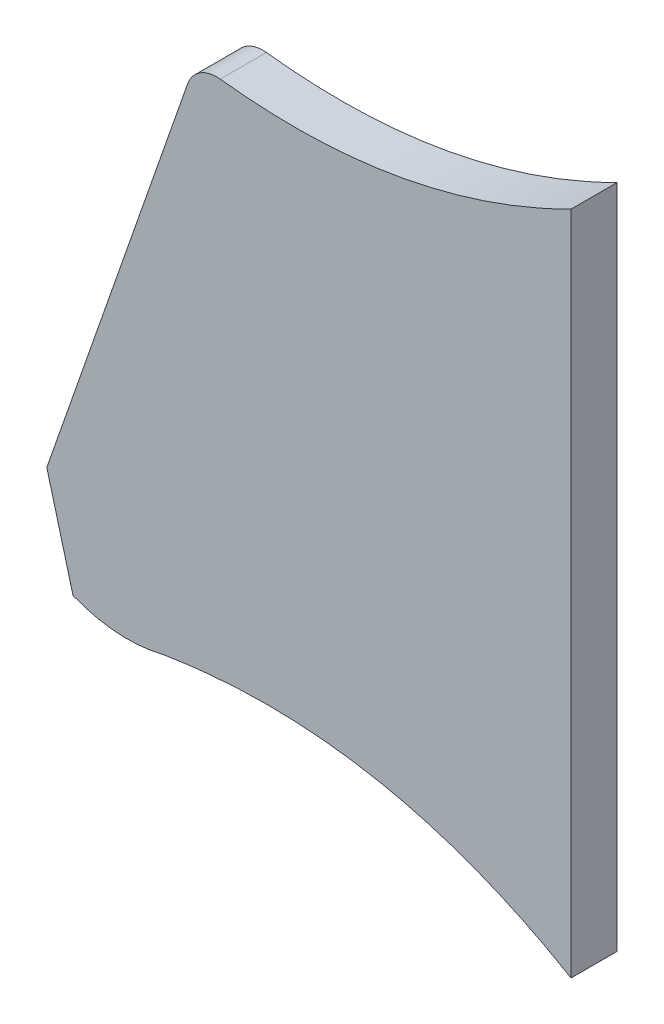
from build123d import *

# Parameters (mm, degrees)
EXTRUDE_1_DEPTH      = 3
EXTRUDE_2_DEPTH      = 3
CUT_EXTRUDE_1_DEPTH  = 10
CUT_EXTRUDE_2_DEPTH  = 10
FILLET_1_R           = 2
CUT_EXTRUDE_3_DEPTH  = 10
CUT_EXTRUDE_4_DEPTH  = 10
CUT_EXTRUDE_5_DEPTH  = 10
CUT_EXTRUDE_6_DEPTH  = 10
CUT_EXTRUDE_7_DEPTH  = 10
EXTRUDE_3_DEPTH      = 3
EXTRUDE_4_DEPTH      = 3
EXTRUDE_5_DEPTH      = 3
CUT_EXTRUDE_8_DEPTH  = 10
CUT_EXTRUDE_9_DEPTH  = 10
CUT_EXTRUDE_10_DEPTH = 10
EXTRUDE_7_DEPTH      = 3
CUT_EXTRUDE_11_DEPTH = 10
CUT_EXTRUDE_12_DEPTH = 10
CUT_EXTRUDE_13_DEPTH = 10
FILLET_2_R           = 2


with BuildPart() as part:
    # 草图1 → 凸台-拉伸1 (new body)
    with BuildSketch(Plane.XY):
        Polygon((18.419709666, -31.180034248), (-18.99770992, -2.648675004), (-11.516544217, 31.616418832), (-4.12729008, 31.616418832), (18.99770992, 31.616418832), (18.99770992, -31.616418832), align=None)
    extrude(amount=EXTRUDE_1_DEPTH)

    # 草图2 → 凸台-拉伸2 (add)
    with BuildSketch(Plane.XY.offset(3)):
        Polygon((18.99770992, 31.616418832), (18.99770992, 39.616418832), (-11.516544217, 31.616418832), align=None)
    extrude(amount=-EXTRUDE_2_DEPTH)

    # 草图3 → 切除-拉伸1 (cut)
    with BuildSketch(Plane.XY.offset(3)):
        with BuildLine():
            Line((-18.99770992, -2.648675004), (18.419709666, -31.180034248))
            Line((18.419709666, -31.180034248), (18.99770992, -31.616418832))
            add(Edge.make_bspline(
                [(-18.99770992, -2.648675004), (-4.909401081, -6.664762391), (12.96021978, -16.653979791), (18.99770992, -31.616418832)],
                knots=[0, 0, 0, 0, 0.839418351, 0.839418351, 0.839418351, 0.839418351], degree=3))
        make_face()
    extrude(amount=-CUT_EXTRUDE_1_DEPTH, mode=Mode.SUBTRACT)

    # 草图4 → 切除-拉伸2 (cut)
    with BuildSketch(Plane.XY.offset(3)):
        with BuildLine():
            Line((18.99770992, 39.616418832), (-11.516544217, 31.616418832))
            add(Edge.make_bspline(
                [(-11.516544217, 31.616418832), (5.451208804, 29.787696143), (18.99770992, 39.616418832)],
                knots=[0, 0, 0, 1, 1, 1], degree=2))
        make_face()
    extrude(amount=-CUT_EXTRUDE_2_DEPTH, mode=Mode.SUBTRACT)

    # 圆角1
    fillet_1_edges = [part.edges().sort_by_distance(p)[0] for p in [
        (-11.516544217, 31.616418832, 1.5),
        (-18.99770992, -2.648675004, 1.5),
    ]]
    fillet(fillet_1_edges, radius=FILLET_1_R)

    # 草图5 → 切除-拉伸3 (cut)
    with BuildSketch(Plane.XY.offset(3)):
        with BuildLine():
            Line((-15.247678714, 14.527147092), (-18.602325656, -0.837743464))
            ThreePointArc((-18.602325656, -0.837743464), (-18.37793511, -2.26862535), (-17.246477615, -3.172825565))
            add(Edge.make_bspline(
                [(-5.349580984, -8.035622202), (-9.34088255, -6.003793842), (-13.405831379, -4.376501244), (-17.246477615, -3.172825565)],
                knots=[0.580679004, 0.580679004, 0.580679004, 0.580679004, 0.804994854, 0.804994854, 0.804994854, 0.804994854], degree=3))
            Line((-5.349580984, -8.035622202), (-15.247678714, 14.527147092))
        make_face()
    extrude(amount=-CUT_EXTRUDE_3_DEPTH, mode=Mode.SUBTRACT)

    # 草图6 → 切除-拉伸4 (cut)
    with BuildSketch(Plane.XY.offset(3)):
        with BuildLine():
            Line((18.99770992, -31.616418832), (18.99770992, -24.041974817))
            add(Edge.make_bspline(
                [(-5.349580984, -8.035622202), (10.712822768, -10.603879461), (18.99770992, -24.041974817)],
                knots=[0, 0, 0, 1, 1, 1], degree=2))
            add(Edge.make_bspline(
                [(18.99770992, -31.616418832), (14.821194408, -21.265949132), (4.982569087, -13.295348934), (-5.349580984, -8.035622202)],
                knots=[0, 0, 0, 0, 0.580679004, 0.580679004, 0.580679004, 0.580679004], degree=3))
        make_face()
    extrude(amount=-CUT_EXTRUDE_4_DEPTH, mode=Mode.SUBTRACT)

    # 草图7 → 切除-拉伸5 (cut)
    with BuildSketch(Plane.XY.offset(3)):
        with BuildLine():
            Line((-7.501131826, -3.13114999), (-5.349580984, -8.035622202))
            add(Edge.make_bspline(
                [(18.99770992, -24.041974817), (10.712822768, -10.603879461), (-5.349580984, -8.035622202)],
                knots=[0, 0, 0, 1, 1, 1], degree=2))
            Line((18.99770992, -24.041974817), (18.99770992, -15.72868914))
            add(Edge.make_bspline(
                [(-7.501131826, -3.13114999), (8.534248318, -3.706395951), (18.99770992, -15.72868914)],
                knots=[0, 0, 0, 1, 1, 1], degree=2))
        make_face()
    extrude(amount=-CUT_EXTRUDE_5_DEPTH, mode=Mode.SUBTRACT)

    # 草图9 → 切除-拉伸6 (cut)
    with BuildSketch(Plane.XY.offset(3)):
        with BuildLine():
            Line((-15.247678714, 14.527147092), (-5.393109321, 31.338029381))
            add(Edge.make_bspline(
                [(-9.792557358, 31.460050353), (-7.562671253, 31.296266706), (-5.393109321, 31.338029381)],
                knots=[0, 0, 0, 1, 1, 1], degree=2))
            ThreePointArc((-9.792557358, 31.460050353), (-11.135472525, 31.068108787), (-11.893031771, 29.892037648))
            Line((-11.893031771, 29.892037648), (-15.247678714, 14.527147092))
        make_face()
    extrude(amount=-CUT_EXTRUDE_6_DEPTH, mode=Mode.SUBTRACT)

    # 草图10 → 切除-拉伸7 (cut)
    with BuildSketch(Plane.XY.offset(3)):
        Polygon((-15.247678714, 14.527147092), (-5.393109321, 31.338029381), (-13.423981873, 10.370019914), align=None)
    extrude(amount=-CUT_EXTRUDE_7_DEPTH, mode=Mode.SUBTRACT)

    # 草图11 → 凸台-拉伸3 (add)
    with BuildSketch(Plane.XY.offset(3)):
        Polygon((-13.423981873, 3.619434962), (-7.501131826, -3.13114999), (-13.423981873, 10.370019914), align=None)
        Polygon((-13.423981873, 16.619434962), (-13.423981873, 10.370019914), (-5.393109321, 31.338029381), align=None)
    extrude(amount=-EXTRUDE_3_DEPTH)

    # 草图12 → 凸台-拉伸4 (add)
    with BuildSketch(Plane.XY.offset(3)):
        with BuildLine():
            Line((18.99770992, -15.72868914), (18.99770992, -16.37868914))
            add(Edge.make_bspline(
                [(-7.501131826, -3.13114999), (8.231572952, -4.86202672), (18.99770992, -16.37868914)],
                knots=[0, 0, 0, 1, 1, 1], degree=2))
            add(Edge.make_bspline(
                [(-7.501131826, -3.13114999), (8.534248318, -3.706395951), (18.99770992, -15.72868914)],
                knots=[0, 0, 0, 1, 1, 1], degree=2))
        make_face()
    extrude(amount=-EXTRUDE_4_DEPTH)

    # 草图14 → 凸台-拉伸5 (add)
    with BuildSketch(Plane.XY.offset(3)):
        Polygon((-13.423981873, 16.619434962), (-5.393109321, 31.338029381), (-15.088083527, 18.619208438), (-15.088083527, 3.619434962), (-7.501131826, -3.13114999), (-13.423981873, 3.619434962), align=None)
    extrude(amount=-EXTRUDE_5_DEPTH)

    # 草图15 → 切除-拉伸8 (cut)
    with BuildSketch(Plane.XY.offset(3)):
        Polygon((-5.393109321, 31.338029381), (-15.088083527, 18.619208438), (-15.088083527, 14.468365238), align=None)
    extrude(amount=-CUT_EXTRUDE_8_DEPTH, mode=Mode.SUBTRACT)

    # 草图16 → 切除-拉伸9 (cut)
    with BuildSketch(Plane.XY.offset(3)):
        with BuildLine():
            Line((18.99770992, -16.37868914), (18.99770992, -10.902642973))
            add(Edge.make_bspline(
                [(-7.501131826, -3.13114999), (7.093543529, -2.593480943), (18.99770992, -10.902642973)],
                knots=[0, 0, 0, 1, 1, 1], degree=2))
            add(Edge.make_bspline(
                [(-7.501131826, -3.13114999), (8.231572952, -4.86202672), (18.99770992, -16.37868914)],
                knots=[0, 0, 0, 1, 1, 1], degree=2))
        make_face()
    extrude(amount=-CUT_EXTRUDE_9_DEPTH, mode=Mode.SUBTRACT)

    # 草图17 → 切除-拉伸10 (cut)
    with BuildSketch(Plane.XY.offset(3)):
        with BuildLine():
            Line((18.99770992, -10.902642973), (18.99770992, -8.085223828))
            add(Edge.make_bspline(
                [(-7.501131826, -3.13114999), (6.687210299, -0.804092069), (18.99770992, -8.085223828)],
                knots=[0, 0, 0, 1, 1, 1], degree=2))
            add(Edge.make_bspline(
                [(18.99770992, -10.902642973), (7.093543529, -2.593480943), (-7.501131826, -3.13114999)],
                knots=[0, 0, 0, 1, 1, 1], degree=2))
        make_face()
    extrude(amount=-CUT_EXTRUDE_10_DEPTH, mode=Mode.SUBTRACT)

    # 草图18 → 凸台-拉伸7 (add)
    with BuildSketch(Plane.XY.offset(3)):
        with BuildLine():
            Line((-15.088083527, 3.619434962), (-13.3809595, -2.744921014))
            add(Edge.make_bspline(
                [(-13.3809595, -2.744921014), (-10.489009144, -3.877027088), (-7.501131826, -3.13114999)],
                knots=[0, 0, 0, 1, 1, 1], degree=2))
            Line((-7.501131826, -3.13114999), (-15.088083527, 3.619434962))
        make_face()
    extrude(amount=-EXTRUDE_7_DEPTH)

    # 草图19 → 切除-拉伸11 (cut)
    with BuildSketch(Plane.XY.offset(3)):
        Polygon((-13.593259145, 17.069422728), (-15.088083527, 14.468365238), (-15.088083527, 11.468365238), align=None)
    extrude(amount=-CUT_EXTRUDE_11_DEPTH, mode=Mode.SUBTRACT)

    # 草图20 → 切除-拉伸12 (cut)
    with BuildSketch(Plane.XY.offset(3)):
        with BuildLine():
            Line((18.99770992, 35.207268429), (18.99770992, 39.616418832))
            add(Edge.make_bspline(
                [(-5.393109321, 31.338029381), (7.941746813, 31.594716807), (18.99770992, 39.616418832)],
                knots=[0, 0, 0, 1, 1, 1], degree=2))
            add(Edge.make_bspline(
                [(-5.393109321, 31.338029381), (7.395374053, 29.358468499), (18.99770992, 35.207268429)],
                knots=[0, 0, 0, 1, 1, 1], degree=2))
        make_face()
    extrude(amount=-CUT_EXTRUDE_12_DEPTH, mode=Mode.SUBTRACT)

    # 草图22 → 切除-拉伸13 (cut)
    with BuildSketch(Plane.XY.offset(3)):
        Polygon((-5.393109324, 31.338029381), (-15.088083527, 3.619434962), (-15.088083527, 11.468365238), (-13.593259145, 17.069422728), align=None)
    extrude(amount=-CUT_EXTRUDE_13_DEPTH, mode=Mode.SUBTRACT)

    # 圆角2
    fillet_2_edges = [part.edges().sort_by_distance(p)[0] for p in [
        (-5.393109321, 31.338029381, 1.5),
    ]]
    fillet(fillet_2_edges, radius=FILLET_2_R)


solid = part.part
